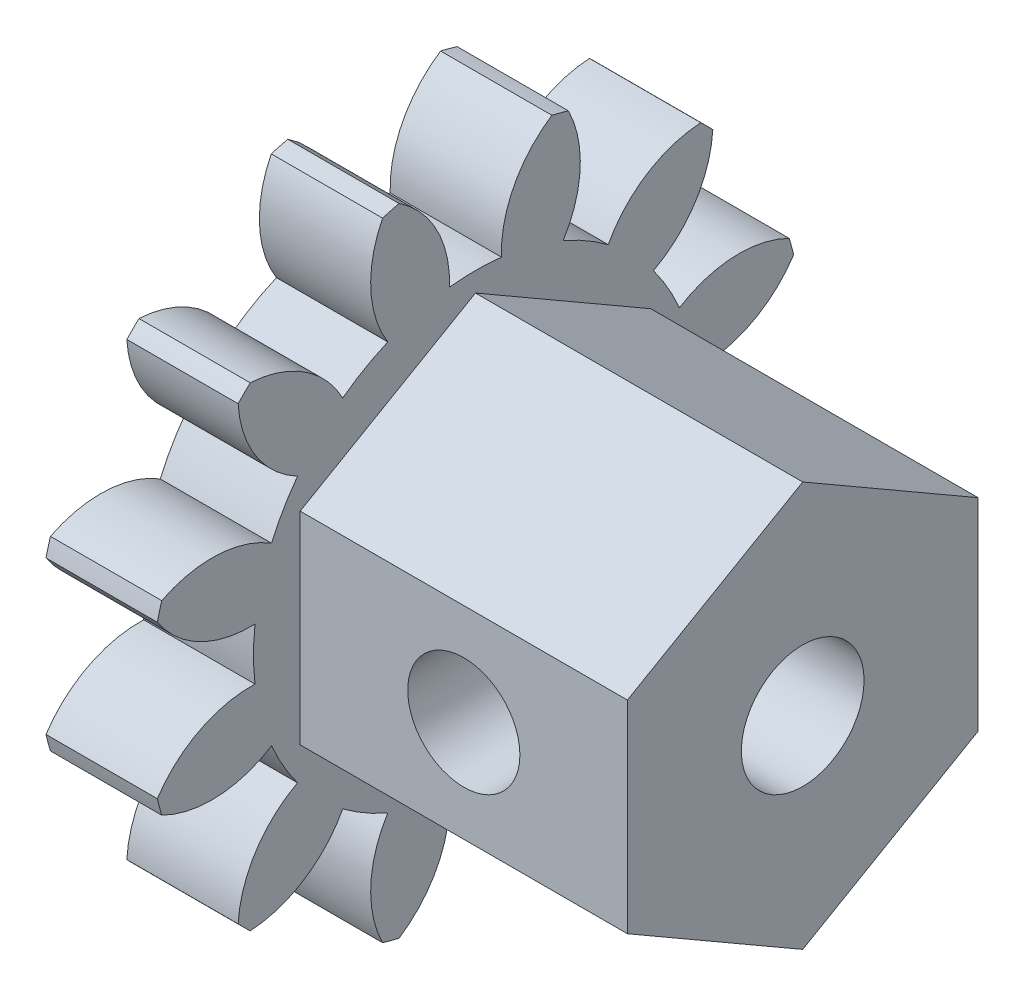
from build123d import *
from build123d.topology import SkipClean

# Parameters (mm, degrees)
BASPROSKE_W         = 4.7625
BASPROSKE_H         = 14
TOOTHCUT_DEPTH      = 21.36372771
TEETHCUTS_COUNT     = 12
TEETHCUTS_ANGLE     = 330
BORSKE_R            = 2.625
BORE_DEPTH          = 50.0000508
BOSS_EXTRUDE1_DEPTH = 13.99999994
SKETCH2_R           = 2.625
CUT_EXTRUDE1_DEPTH  = 27.882327142
SKETCH3_R           = 2.4
CUT_EXTRUDE2_DEPTH  = 32.354499992


with BuildPart() as part:
    # BasProSke → Base-Revolve (revolve)
    with BuildSketch(Plane(origin=(0, 0, 0), x_dir=(1, 0, 0), z_dir=(0, 1, 0)), mode=Mode.PRIVATE) as base_revolve_sk:
        with Locations((2.38125, 7)):
            Rectangle(BASPROSKE_W, BASPROSKE_H)
    revolve(base_revolve_sk.sketch.rotate(Axis((-10, 0, 0), (1, 0, 0)), 180), axis=Axis((-10, 0, 0), (1, 0, 0)))

    # TooCutSke → ToothCut (cut, through all)
    with BuildSketch(Plane(origin=(0, 0, 0), x_dir=(0, 0, -1), z_dir=(1, 0, 0))):
        with BuildLine():
            ThreePointArc((1.111908866, 9.433698091), (0, 9.499), (-1.111908866, 9.433698091))
            ThreePointArc((-1.111908866, 9.433698091), (-1.651516138, 11.821129337), (-3.298149691, 13.632096456))
            ThreePointArc((-3.298149691, 13.632096456), (0, 14.0254), (3.298149691, 13.632096456))
            ThreePointArc((3.298149691, 13.632096456), (1.651516138, 11.821129337), (1.111908866, 9.433698091))
        make_face()
    toothcut = extrude(amount=TOOTHCUT_DEPTH, mode=Mode.SUBTRACT)

    # TeethCuts: ToothCut ×12 about axis
    teethcuts_axis = Axis((-10, 0, 0), (1, 0, 0))
    for i in range(1, TEETHCUTS_COUNT):
        add(toothcut.rotate(teethcuts_axis, i * TEETHCUTS_ANGLE / (TEETHCUTS_COUNT - 1)), mode=Mode.SUBTRACT)

    # BorSke → Bore (cut, symmetric)
    with BuildSketch(Plane(origin=(0, 0, 0), x_dir=(0, 0, -1), z_dir=(1, 0, 0))):
        with Locations(Location((0, 0, 0), (0, 0, 180))):
            Circle(BORSKE_R)
    extrude(amount=BORE_DEPTH, both=True, mode=Mode.SUBTRACT)

    # Sketch1 → Boss-Extrude1 (add)
    with BuildSketch(Plane(origin=(4.7625, 0, 0), x_dir=(0, 0, -1), z_dir=(1, 0, 0))):
        Polygon((0, 8.660254038), (-7.5, 4.330127019), (-7.5, -4.330127019), (0, -8.660254038), (7.5, -4.330127019), (7.5, 4.330127019), align=None)
    extrude(amount=BOSS_EXTRUDE1_DEPTH)

    # Sketch2 → Cut-Extrude1 (cut, through all)
    with BuildSketch(Plane(origin=(18.76249994, 0, 0), x_dir=(0, 0, -1), z_dir=(1, 0, 0))):
        Circle(SKETCH2_R)
    extrude(amount=-CUT_EXTRUDE1_DEPTH, mode=Mode.SUBTRACT)

    # Sketch3 → Cut-Extrude2 (cut, through all)
    with SkipClean():  # the faces are left unmerged after this step: merging them gives an invalid solid
        with BuildSketch(Plane.XY.offset(7.5)):
            with Locations((11.76249997, 0)):
                Circle(SKETCH3_R)
        extrude(amount=-CUT_EXTRUDE2_DEPTH, mode=Mode.SUBTRACT)


solid = part.part
